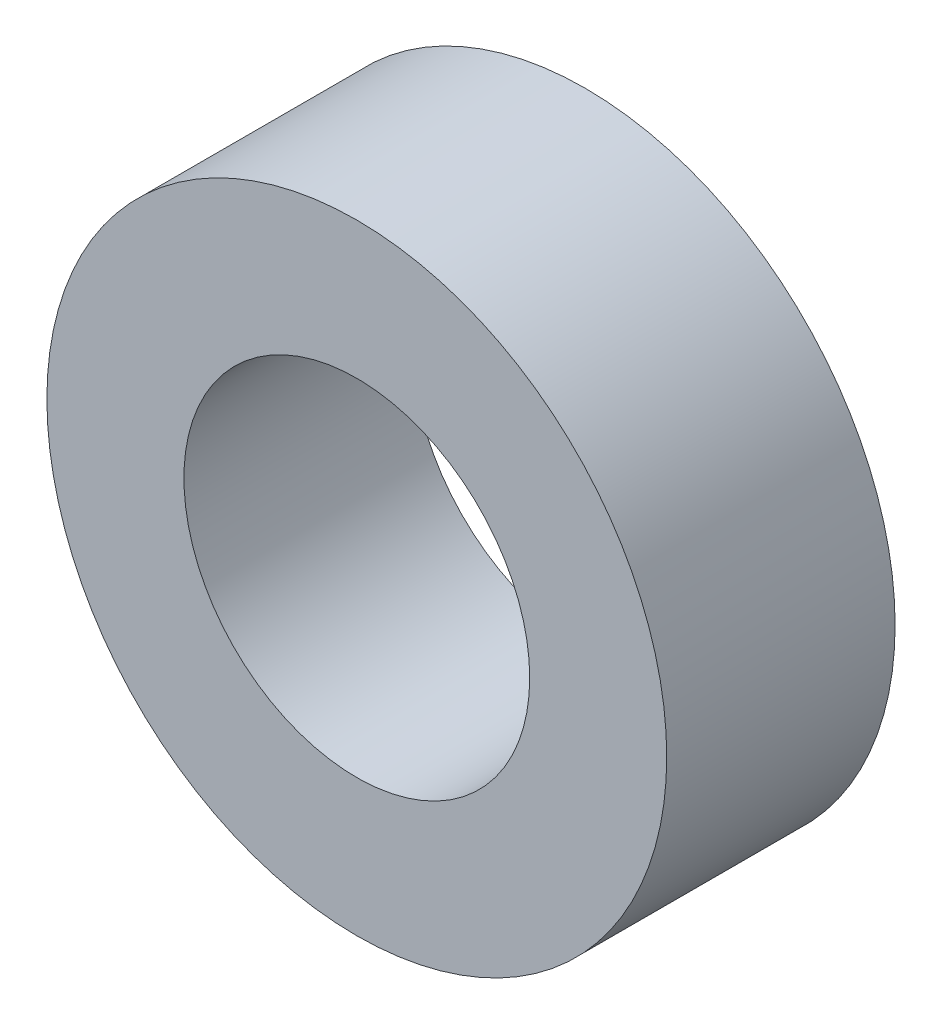
from build123d import *

# Parameters (mm, degrees)
CROQUIS1_R              = 9.5
CROQUIS1_R_2            = 5.3
SALIENTE_EXTRUIR1_DEPTH = 7


with BuildPart() as part:
    # Croquis1 → Saliente-Extruir1 (new body)
    with BuildSketch(Plane.XY):
        Circle(CROQUIS1_R)
        Circle(CROQUIS1_R_2, mode=Mode.SUBTRACT)
    extrude(amount=SALIENTE_EXTRUIR1_DEPTH)


solid = part.part
